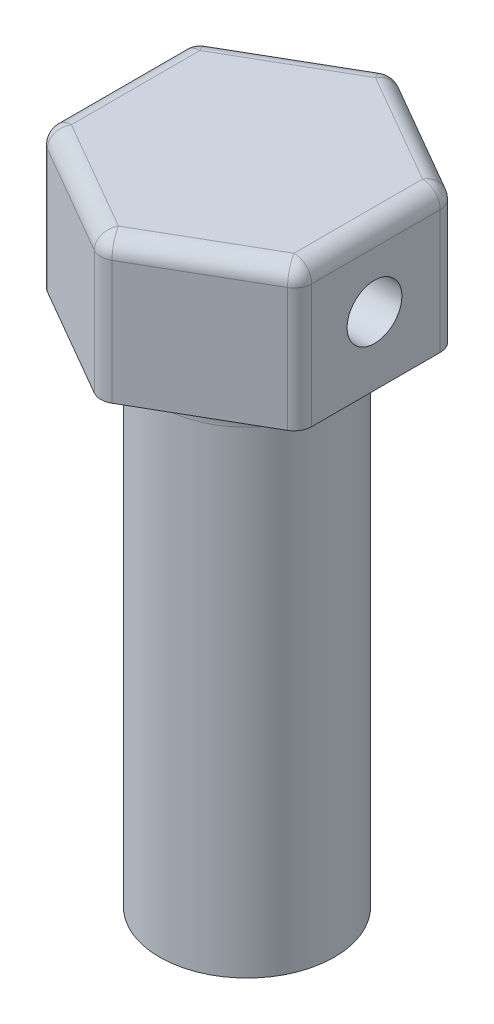
from build123d import *

# Parameters (mm, degrees)
BOSS_EXTRUDE1_DEPTH = 8
SKETCH2_R           = 4.95
BOSS_EXTRUDE2_DEPTH = 29
FILLET1_R           = 2
SKETCH3_R           = 1.55
CUT_EXTRUDE1_DEPTH  = 34.544199697
FILLET2_R           = 1
CUT_EXTRUDE3_START  = -2
SKETCH5_R           = 2.0875
CUT_EXTRUDE3_DEPTH  = 2


with BuildPart() as part:
    # Sketch1 → Boss-Extrude1 (new body)
    with BuildSketch(Plane(origin=(0, 0, 0), x_dir=(1, 0, 0), z_dir=(0, 1, 0))):
        Polygon((7.3, -4.214656965), (7.3, 4.214656965), (0, 8.42931393), (-7.3, 4.214656965), (-7.3, -4.214656965), (0, -8.42931393), align=None)
    extrude(amount=BOSS_EXTRUDE1_DEPTH)

    # Sketch2 → Boss-Extrude2 (add)
    with BuildSketch(Plane.XZ):
        with Locations(Location((0, 0, 0), (0, 0, 90))):
            Circle(SKETCH2_R)
        with BuildLine():
            Line((-1.5, 1.451776928), (-1.5, -1.451776928))
            ThreePointArc((-1.5, -1.451776928), (2.0875, 0), (-1.5, 1.451776928))
        make_face(mode=Mode.SUBTRACT)
    extrude(amount=BOSS_EXTRUDE2_DEPTH)

    # Fillet1
    fillet1_edges = [part.edges().sort_by_distance(p)[0] for p in [
        (0, 0, -4.95),
    ]]
    fillet(fillet1_edges, radius=FILLET1_R)

    # Sketch3 → Cut-Extrude1 (cut, through all)
    with BuildSketch(Plane(origin=(7.3, 0, 0), x_dir=(0, 0, -1), z_dir=(1, 0, 0))):
        with Locations((-0.085343035, 3.85)):
            Circle(SKETCH3_R)
    extrude(amount=-CUT_EXTRUDE1_DEPTH, mode=Mode.SUBTRACT)

    # Fillet2
    fillet2_edges = [part.edges().sort_by_distance(p)[0] for p in [
        (0, 4, 8.42931393),
        (-7.3, 4, 4.214656965),
        (-7.3, 4, -4.214656965),
        (0, 4, -8.42931393),
        (7.3, 4, -4.214656965),
        (7.3, 4, 4.214656965),
        (3.65, 8, -6.321985448),
        (-3.65, 8, -6.321985448),
        (-7.3, 8, 0),
        (-3.65, 8, 6.321985448),
        (3.65, 8, 6.321985448),
        (7.3, 8, 0),
    ]]
    fillet(fillet2_edges, radius=FILLET2_R)

    # Sketch5 → Cut-Extrude3 (cut)
    with BuildSketch(Plane.XZ.offset(29).offset(CUT_EXTRUDE3_START)):
        with Locations(Location((0, 0, 0), (0, 0, 135.935955789))):
            Circle(SKETCH5_R)
    extrude(amount=CUT_EXTRUDE3_DEPTH, mode=Mode.SUBTRACT)


solid = part.part
